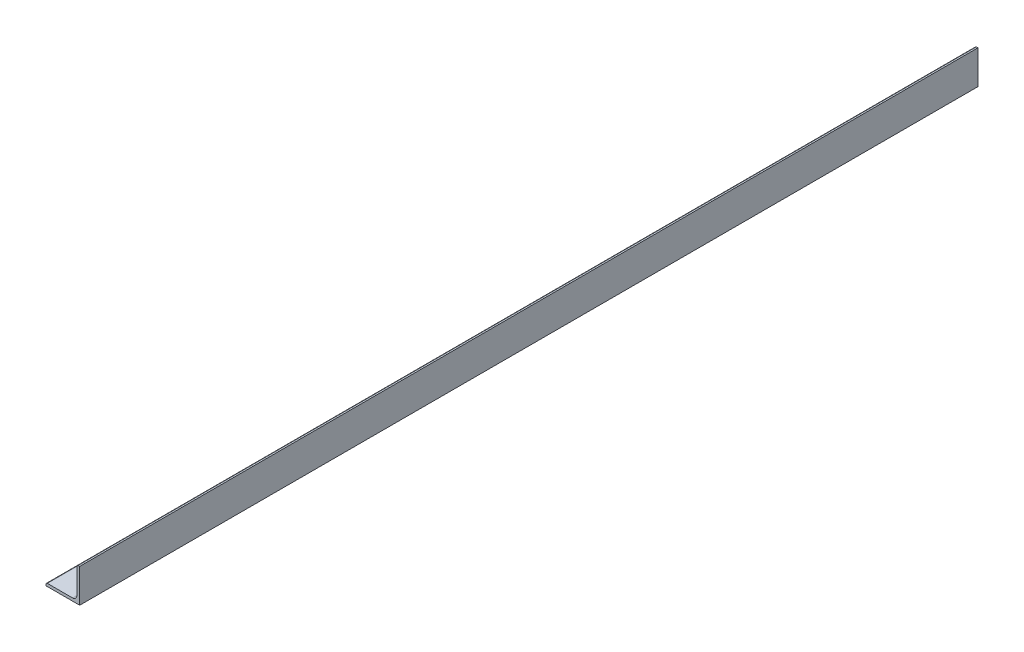
from build123d import *

# Parameters (mm, degrees)
BOSS_EXTRUDE1_DEPTH        = 254
F_10_CLEARANCE_HOLE1_D     = 4.9784
F_10_CLEARANCE_HOLE1_DEPTH = 3.302
F_10_CLEARANCE_HOLE1_TIP   = 1.495662253


with BuildPart() as part:
    # Sketch2 → Boss-Extrude1 (new, symmetric)
    with BuildSketch(Plane.XY):
        with BuildLine():
            Line((-9.525, -9.525), (9.525, -9.525))
            Line((9.525, -9.525), (9.525, 9.525))
            Line((9.525, 9.525), (8.73125, 9.525))
            ThreePointArc((8.73125, 9.525), (8.169983992, 9.292516008), (7.9375, 8.73125))
            Line((7.9375, 8.73125), (7.9375, -5.5499))
            ThreePointArc((7.9375, -5.5499), (7.238188151, -7.238188151), (5.5499, -7.9375))
            Line((5.5499, -7.9375), (-8.73125, -7.9375))
            ThreePointArc((-8.73125, -7.9375), (-9.292516008, -8.169983992), (-9.525, -8.73125))
            Line((-9.525, -8.73125), (-9.525, -9.525))
        make_face()
    extrude(amount=BOSS_EXTRUDE1_DEPTH, both=True)

    # #10 Clearance Hole1
    with Locations(Plane(origin=(0, -9.525, 0), x_dir=(-1, 0, 0), z_dir=(0, -1, 0))):
        with Locations((-3.175, 241.3), (-3.175, 215.9), (-3.175, -241.3), (-3.175, -215.9)):
            Hole(F_10_CLEARANCE_HOLE1_D / 2, depth=F_10_CLEARANCE_HOLE1_DEPTH)
            with Locations((0, 0, -(F_10_CLEARANCE_HOLE1_DEPTH + F_10_CLEARANCE_HOLE1_TIP / 2))):  # 118° drill point
                Cone(0, F_10_CLEARANCE_HOLE1_D / 2, F_10_CLEARANCE_HOLE1_TIP, mode=Mode.SUBTRACT)


solid = part.part
